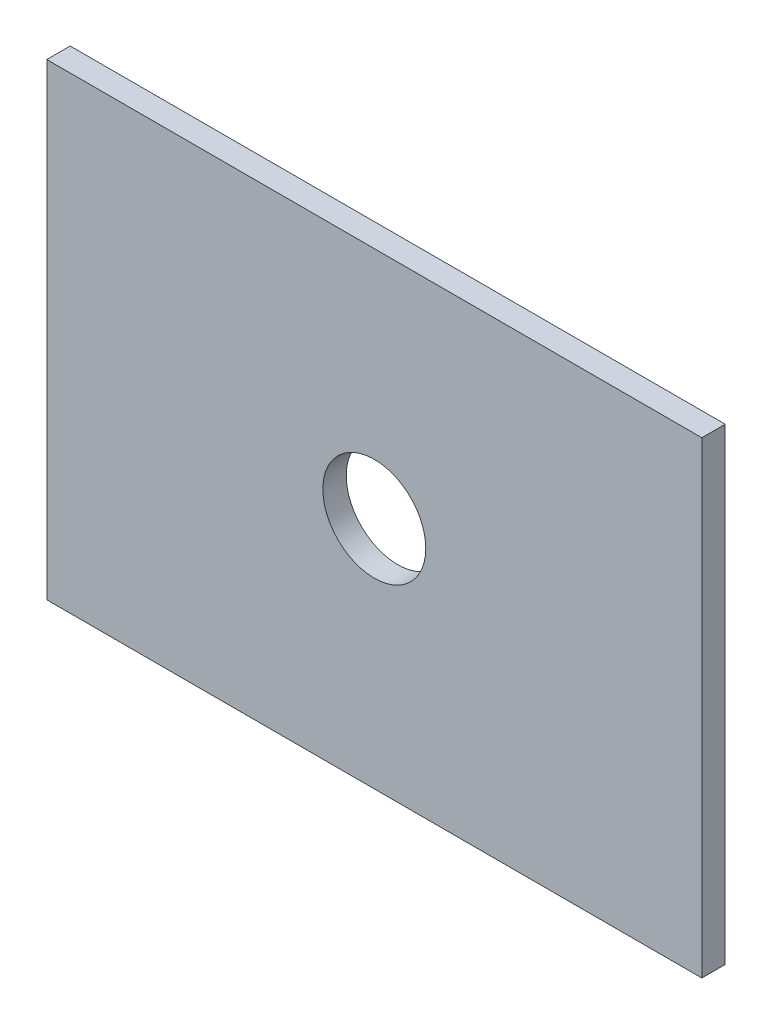
from build123d import *

# Parameters (mm, degrees)
SKIZZE1_W                       = 140
SKIZZE1_H                       = 100
AUFSATZ_LINEAR_AUSTRAGEN1_DEPTH = 5
SKIZZE2_R                       = 11
SCHNITT_LINEAR_AUSTRAGEN1_DEPTH = 87.168439698


with BuildPart() as part:
    # Skizze1 → Aufsatz-Linear austragen1 (new body)
    with BuildSketch(Plane.XY):
        Rectangle(SKIZZE1_W, SKIZZE1_H)
    extrude(amount=AUFSATZ_LINEAR_AUSTRAGEN1_DEPTH)

    # Skizze2 → Schnitt-Linear austragen1 (cut, through all)
    with BuildSketch(Plane.XY.offset(5)):
        Circle(SKIZZE2_R)
    extrude(amount=-SCHNITT_LINEAR_AUSTRAGEN1_DEPTH, mode=Mode.SUBTRACT)


solid = part.part
